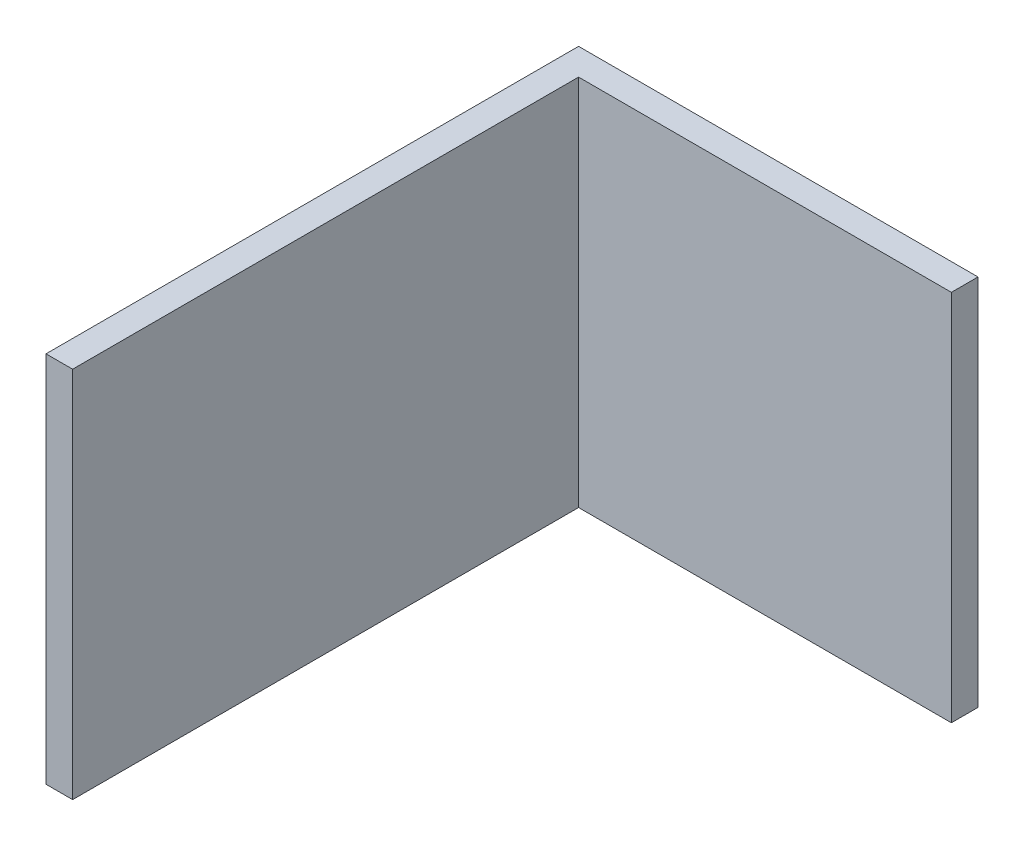
from build123d import *

# Parameters (mm, degrees)
SKETCH2_W           = 500
SKETCH2_H           = 7000
BOSS_EXTRUDE1_DEPTH = 10000
SKETCH3_W           = 500
SKETCH3_H           = 7000
BOSS_EXTRUDE2_DEPTH = 7000


with BuildPart() as part:
    # Sketch2 → Boss-Extrude1 (new body)
    with BuildSketch(Plane.XY):
        with Locations((250, 3500)):
            Rectangle(SKETCH2_W, SKETCH2_H)
    extrude(amount=BOSS_EXTRUDE1_DEPTH)

    # Sketch3 → Boss-Extrude2 (add)
    with BuildSketch(Plane(origin=(500, 0, 0), x_dir=(0, 0, -1), z_dir=(1, 0, 0))):
        with Locations((-250, 3500)):
            Rectangle(SKETCH3_W, SKETCH3_H)
    extrude(amount=BOSS_EXTRUDE2_DEPTH)


solid = part.part
